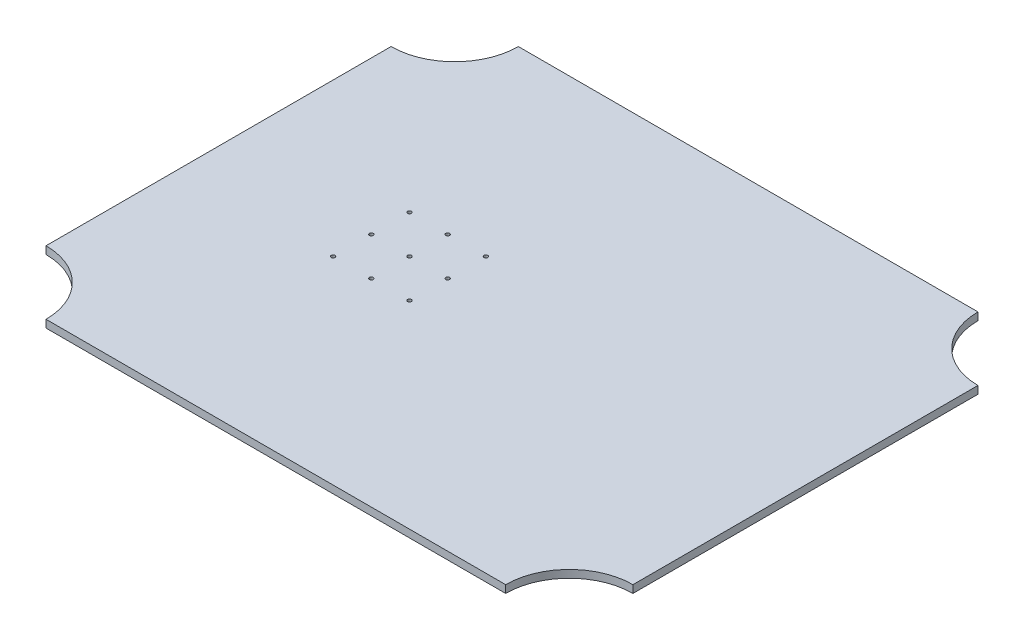
from build123d import *

# Parameters (mm, degrees)
SKETCH_1_R      = 1.5
EXTRUDE_1_DEPTH = 6


with BuildPart() as part:
    # 草图1 → 凸台-拉伸1 (new body)
    with BuildSketch(Plane(origin=(0, 0, 0), x_dir=(1, 0, 0), z_dir=(0, 1, 0))):
        with BuildLine():
            Line((1250.81279875, 185.5), (1611.81279875, 185.5))
            ThreePointArc((1611.81279875, 185.5), (1626.457459691, 150.144660941), (1661.81279875, 135.5))
            Line((1661.81279875, 135.5), (1661.81279875, -135.5))
            ThreePointArc((1661.81279875, -135.5), (1626.457459691, -150.144660941), (1611.81279875, -185.5))
            Line((1611.81279875, -185.5), (1250.81279875, -185.5))
            ThreePointArc((1250.81279875, -185.5), (1236.16813781, -150.144660941), (1200.81279875, -135.5))
            Line((1200.81279875, -135.5), (1200.81279875, 135.5))
            ThreePointArc((1200.81279875, 135.5), (1236.16813781, 150.144660941), (1250.81279875, 185.5))
        make_face()
        with Locations(Location((1320.81279875, 0, 0), (0, 0, 270))):
            Circle(SKETCH_1_R, mode=Mode.SUBTRACT)
        with Locations(Location((1320.81279875, 30, 0), (0, 0, 270))):
            Circle(SKETCH_1_R, mode=Mode.SUBTRACT)
        with Locations(Location((1350.81279875, 30, 0), (0, 0, 270))):
            Circle(SKETCH_1_R, mode=Mode.SUBTRACT)
        with Locations(Location((1350.81279875, 0, 0), (0, 0, 270))):
            Circle(SKETCH_1_R, mode=Mode.SUBTRACT)
        with Locations(Location((1350.81279875, -30, 0), (0, 0, 90))):
            Circle(SKETCH_1_R, mode=Mode.SUBTRACT)
        with Locations(Location((1320.81279875, -30, 0), (0, 0, 90))):
            Circle(SKETCH_1_R, mode=Mode.SUBTRACT)
        with Locations(Location((1380.81279875, -30, 0), (0, 0, 270))):
            Circle(SKETCH_1_R, mode=Mode.SUBTRACT)
        with Locations(Location((1380.81279875, 0, 0), (0, 0, 90))):
            Circle(SKETCH_1_R, mode=Mode.SUBTRACT)
        with Locations(Location((1380.81279875, 30, 0), (0, 0, 90))):
            Circle(SKETCH_1_R, mode=Mode.SUBTRACT)
    extrude(amount=EXTRUDE_1_DEPTH)


solid = part.part
